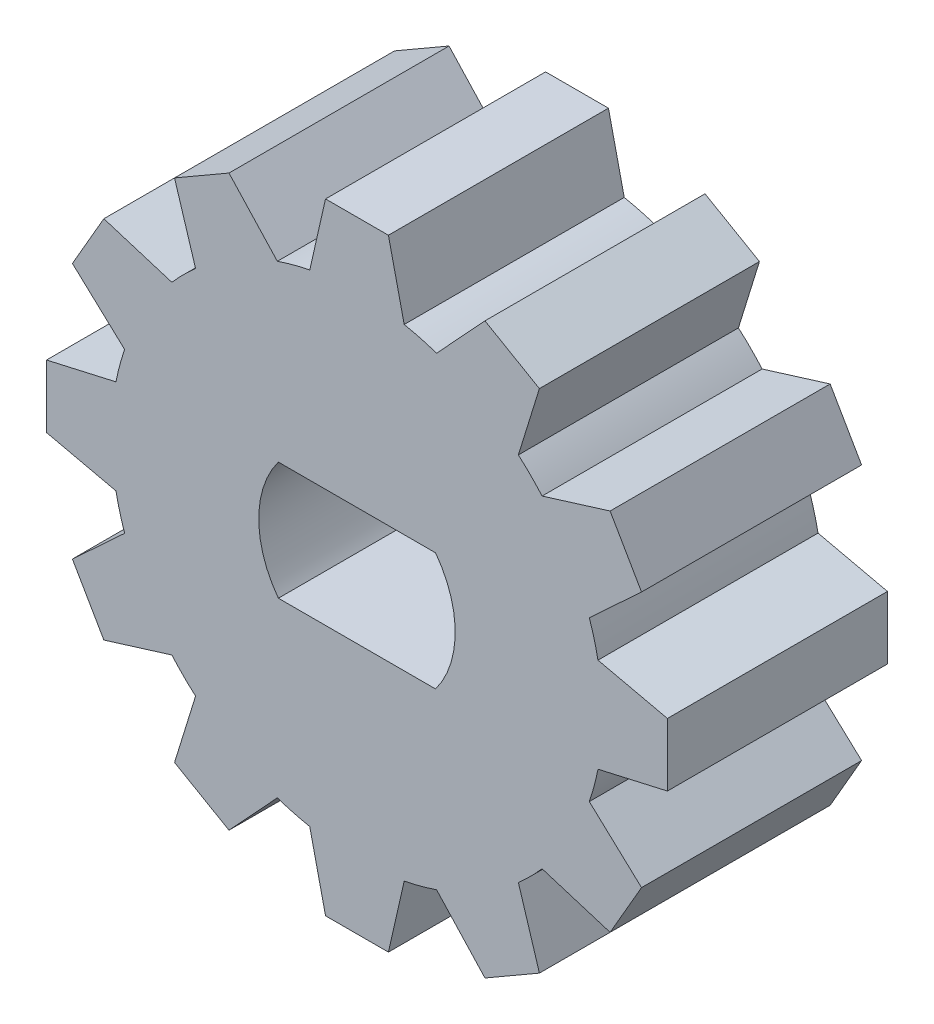
from build123d import *

# Parameters (mm, degrees)
SKETCH1_R           = 6.25
BOSS_EXTRUDE1_DEPTH = 5.6
BOSS_EXTRUDE2_DEPTH = 5.6
CIRPATTERN1_COUNT   = 12
CUT_EXTRUDE1_DEPTH  = 7


with BuildPart() as part:
    # Sketch1 → Boss-Extrude1 (new body)
    with BuildSketch(Plane.XY):
        Circle(SKETCH1_R)
    extrude(amount=BOSS_EXTRUDE1_DEPTH)

    # Sketch3 → Boss-Extrude2 (add)
    with BuildSketch(Plane.XY):
        Polygon((-0.8, 7.9), (0.8, 7.9), (1.3, 5.7), (-1.3, 5.7), align=None)
    boss_extrude2 = extrude(amount=BOSS_EXTRUDE2_DEPTH)

    # CirPattern1: Boss-Extrude2 ×12 about axis
    cirpattern1_axis = Axis((0, 0, 0), (0, 0, 1))
    for i in range(1, CIRPATTERN1_COUNT):
        add(boss_extrude2.rotate(cirpattern1_axis, i * 360 / CIRPATTERN1_COUNT))

    # Sketch4 → Cut-Extrude1 (cut)
    with BuildSketch(Plane.XY):
        with BuildLine():
            Line((-2, -1.5), (2, -1.5))
            ThreePointArc((2, -1.5), (2.5, 0), (2, 1.5))
            Line((2, 1.5), (-2, 1.5))
            ThreePointArc((-2, 1.5), (-2.5, 0), (-2, -1.5))
        make_face()
    extrude(amount=CUT_EXTRUDE1_DEPTH, mode=Mode.SUBTRACT)


solid = part.part
